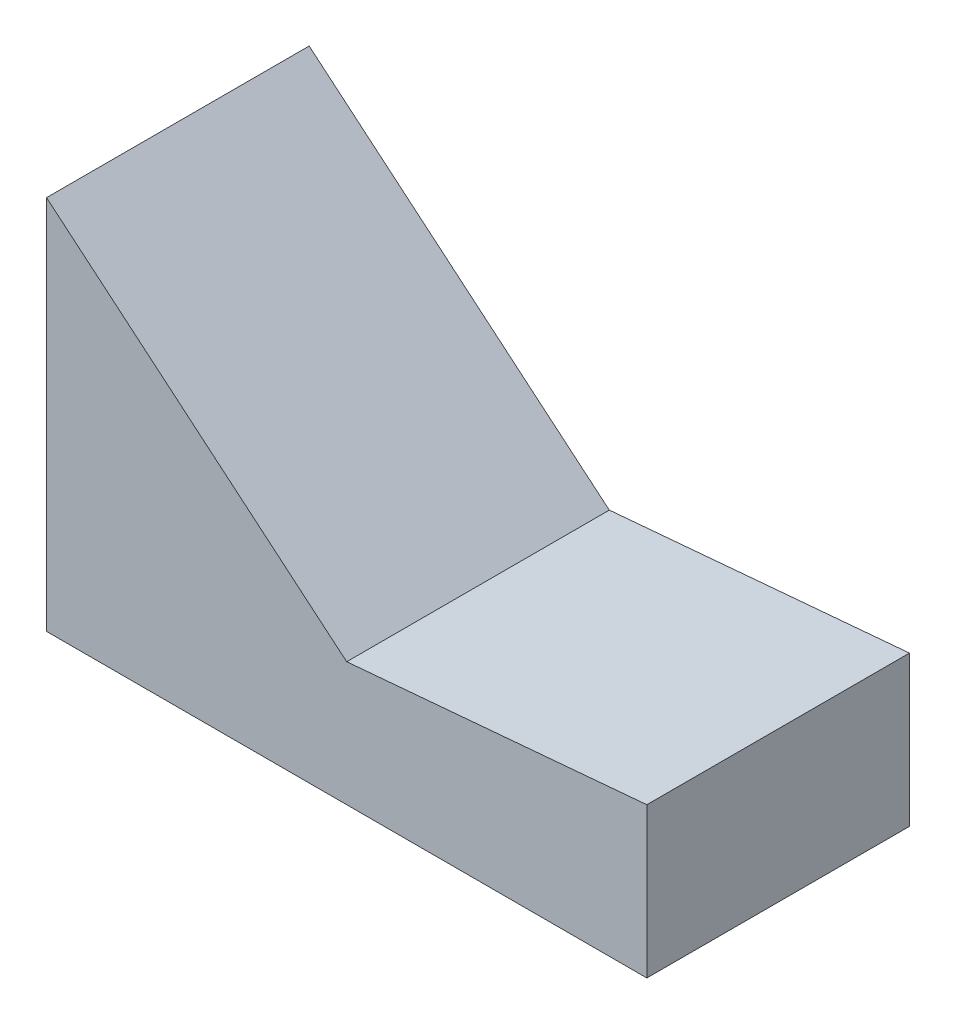
from build123d import *

# Parameters (mm, degrees)
BOSS_EXTRU_1_DEPTH = 35


with BuildPart() as part:
    # Esquisse1 → Boss.-Extru.1 (new body)
    with BuildSketch(Plane.XY):
        Polygon((0, 0), (-80, 0), (-80, 50.064438706), (-40, 16.500453459), (0, 20), align=None)
    extrude(amount=BOSS_EXTRU_1_DEPTH)


solid = part.part
